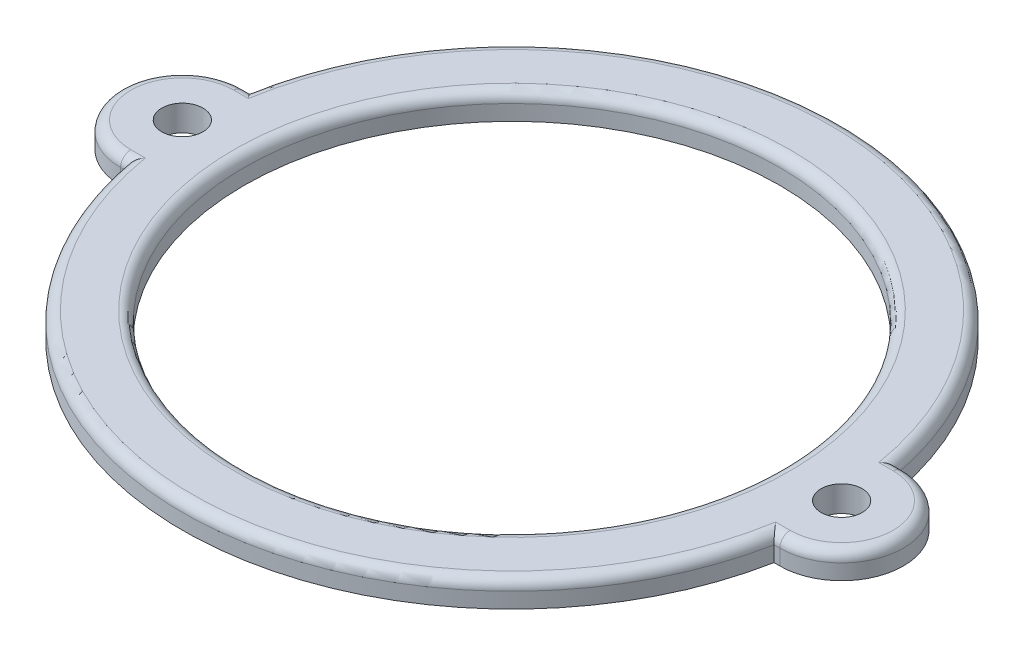
from build123d import *

# Parameters (mm, degrees)
CROQUIS1_R              = 26
CROQUIS1_R_2            = 2
SALIENTE_EXTRUIR1_DEPTH = 2.5
REDONDEO1_R             = 1


with BuildPart() as part:
    # Croquis1 → Saliente-Extruir1 (new body)
    with BuildSketch(Plane(origin=(0, 0, 0), x_dir=(1, 0, 0), z_dir=(0, 1, 0))):
        with BuildLine():
            Line((-32, 6), (-31.432467291, 6))
            ThreePointArc((-31.432467291, 6), (0, 32), (31.432467291, 6))
            Line((31.432467291, 6), (32, 6))
            ThreePointArc((32, 6), (38, 0), (32, -6))
            Line((32, -6), (31.432467291, -6))
            ThreePointArc((31.432467291, -6), (0, -32), (-31.432467291, -6))
            Line((-31.432467291, -6), (-32, -6))
            ThreePointArc((-32, -6), (-38, 0), (-32, 6))
        make_face()
        with Locations(Location((0, 0, 0), (0, 0, 270))):
            Circle(CROQUIS1_R, mode=Mode.SUBTRACT)
        with Locations(Location((-32, 0, 0), (0, 0, 270))):
            Circle(CROQUIS1_R_2, mode=Mode.SUBTRACT)
        with Locations(Location((32, 0, 0), (0, 0, 270))):
            Circle(CROQUIS1_R_2, mode=Mode.SUBTRACT)
    extrude(amount=SALIENTE_EXTRUIR1_DEPTH)

    # Redondeo1
    redondeo1_edges = [part.edges().sort_by_distance(p)[0] for p in [
        (0, 2.5, -32),
        (-31.716233646, 2.5, -6),
        (-38, 2.5, 0),
        (0, 2.5, -26),
        (-31.716233646, 2.5, 6),
        (0, 2.5, 32),
        (31.716233646, 2.5, 6),
        (38, 2.5, 0),
        (31.716233646, 2.5, -6),
    ]]
    fillet(redondeo1_edges, radius=REDONDEO1_R)


solid = part.part
